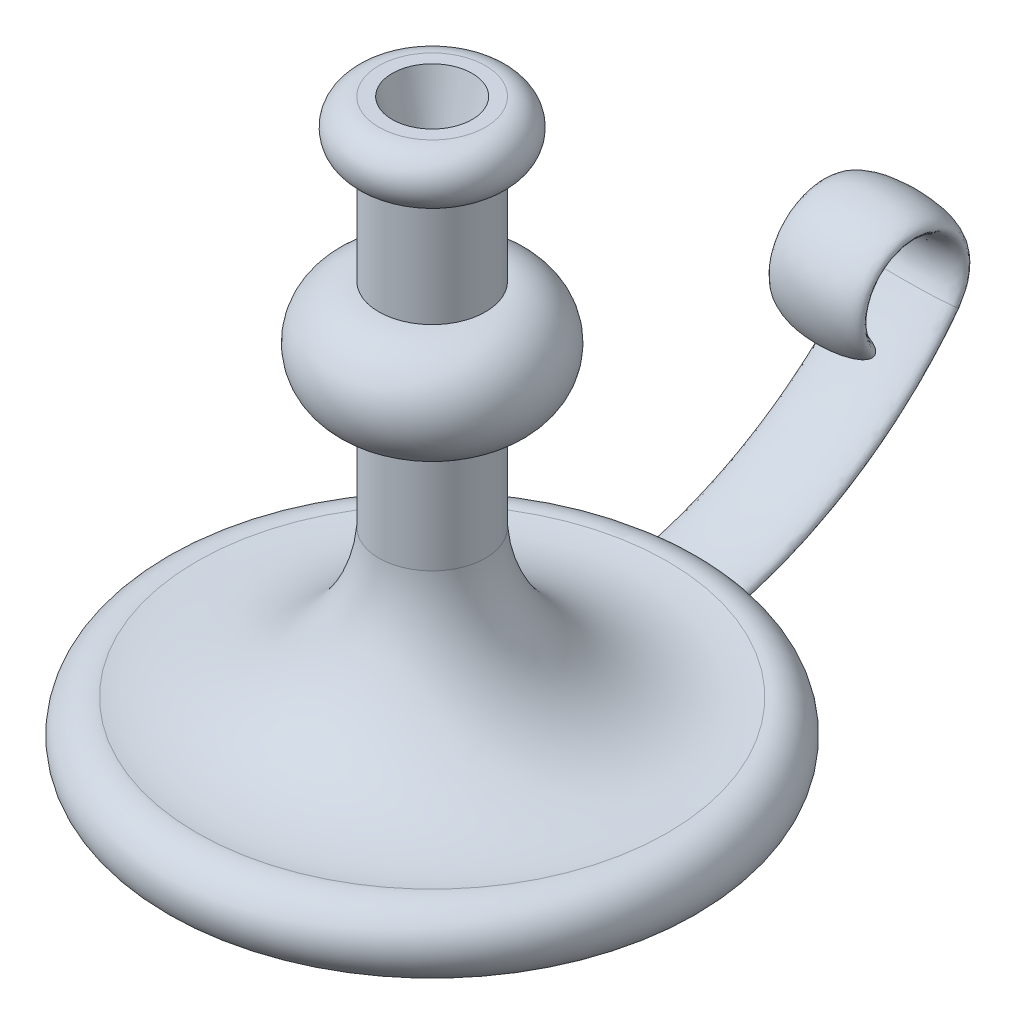
from build123d import *

# Parameters (mm, degrees)
SZKIC6_RX = 17.5
SZKIC6_RY = 5


with BuildPart() as part:
    # Szkic1 → Obrót1 (revolve)
    with BuildSketch(Plane.XY, mode=Mode.PRIVATE) as obr_t1_sk:
        with BuildLine():
            Line((0, 220), (0, 0))
            Line((0, 0), (90, 0))
            ThreePointArc((90, 0), (102.469165648, 13.377444039), (88.249440789, 24.876814713))
            ThreePointArc((88.249440789, 24.876814713), (42.147094318, 37.608598857), (20, 80))
            Line((20, 80), (20, 120))
            ThreePointArc((20, 120), (40, 140), (20, 160))
            Line((20, 160), (20, 200))
            ThreePointArc((20, 200), (30, 210), (20, 220))
            Line((20, 220), (0, 220))
        make_face()
    revolve(obr_t1_sk.sketch.rotate(Axis((0, 220, 0), (0, -1, 0)), 90), axis=Axis((0, 220, 0), (0, -1, 0)))

    # Szkic3 → Wycięcie-obrót1 (revolve, cut)
    with BuildSketch(Plane.XY, mode=Mode.PRIVATE) as wyci_cie_obr_t1_sk:
        Polygon((0, 220), (0, 195), (8.301270189, 195), (15, 220), align=None)
    revolve(wyci_cie_obr_t1_sk.sketch.rotate(Axis((0, 220, 0), (0, -1, 0)), 90), axis=Axis((0, 220, 0), (0, -1, 0)), mode=Mode.SUBTRACT)

    # Wyciągnięcie po ścieżce1: sweep along a path in Szkic2
    with BuildLine(Plane(origin=(0, 0, 0), x_dir=(0, 0, -1), z_dir=(1, 0, 0))) as wyci_gni_cie_po_cie_ce1_path:
        Line((0, 10), (60, 10))
        ThreePointArc((60, 10), (127.082039325, 25.83592135), (180, 70))
        ThreePointArc((180, 70), (164, 102), (148, 70))
    # Szkic6 → Wyciągnięcie po ścieżce1 (sweep)
    with BuildSketch(Plane.XY):
        with Locations((0, 10.513268193)):
            Ellipse(SZKIC6_RX, SZKIC6_RY)
    sweep(path=wyci_gni_cie_po_cie_ce1_path.line)


solid = part.part
